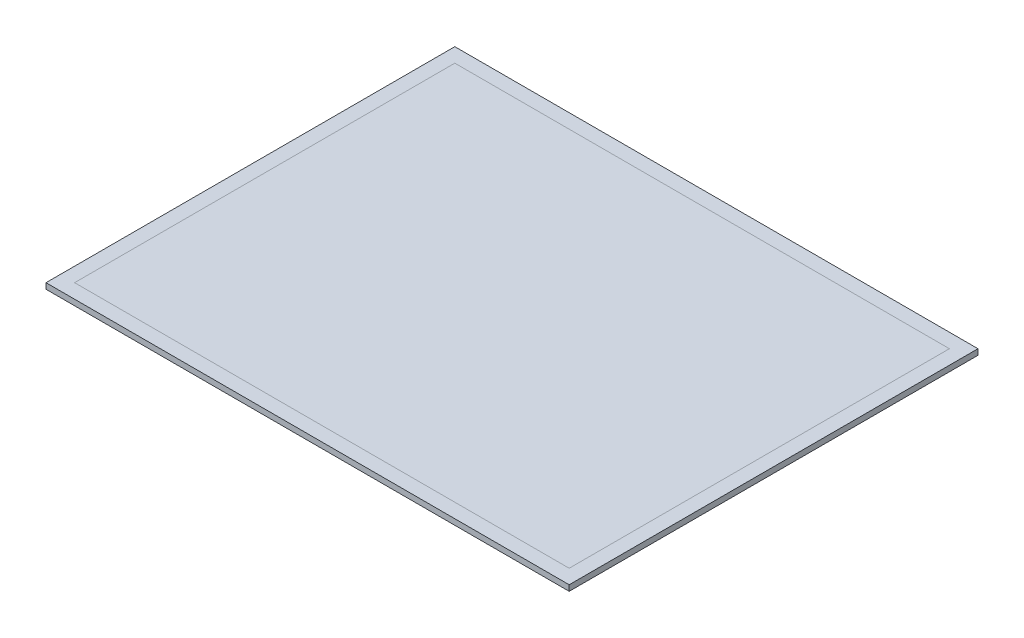
from build123d import *

# Parameters (mm, degrees)
SKETCH1_W           = 183
SKETCH1_H           = 143
SKETCH1_W_2         = 173
SKETCH1_H_2         = 133
BOSS_EXTRUDE1_DEPTH = 2
SKETCH1_2_W         = 173
SKETCH1_2_H         = 133
BOSS_EXTRUDE2_DEPTH = 2


with BuildPart() as part:
    # Sketch1 → Boss-Extrude1 (new body)
    with BuildSketch(Plane(origin=(0, 0, 0), x_dir=(1, 0, 0), z_dir=(0, 1, 0))):
        Rectangle(SKETCH1_W, SKETCH1_H)
        Rectangle(SKETCH1_W_2, SKETCH1_H_2, mode=Mode.SUBTRACT)
    extrude(amount=BOSS_EXTRUDE1_DEPTH)


with BuildPart() as body_2:
    # Sketch1<2> → Boss-Extrude2 (new body)
    with BuildSketch(Plane(origin=(0, 0, 0), x_dir=(1, 0, 0), z_dir=(0, 1, 0))):
        Rectangle(SKETCH1_2_W, SKETCH1_2_H)
    extrude(amount=BOSS_EXTRUDE2_DEPTH)


solid = Compound([part.part, body_2.part])
